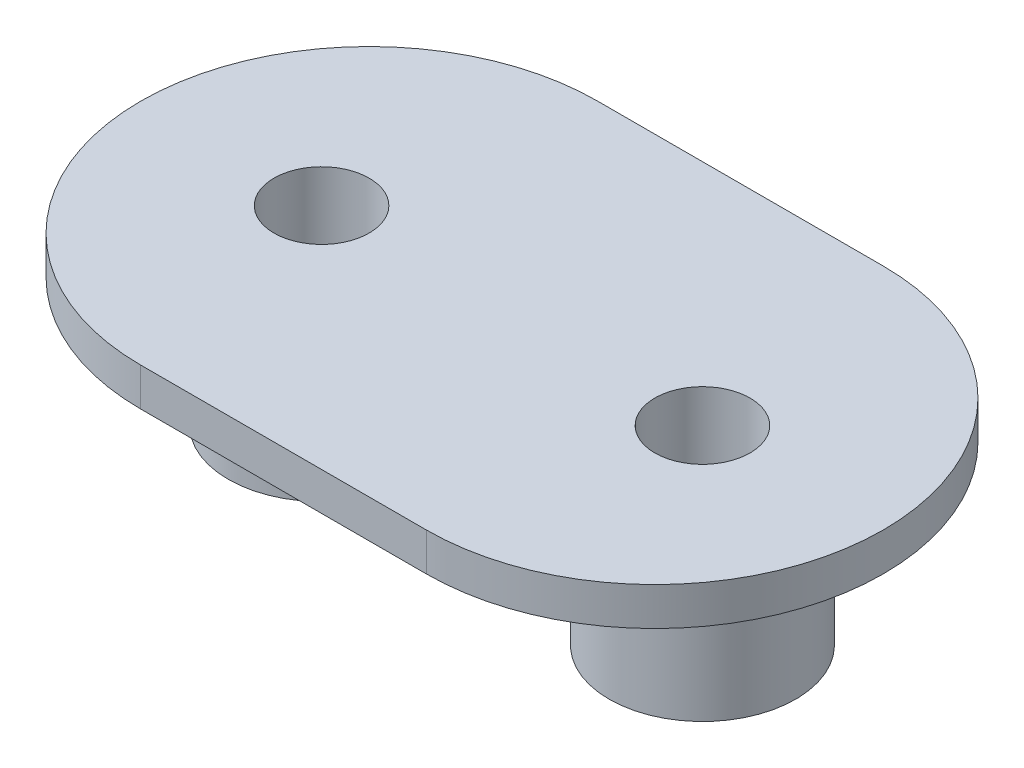
from build123d import *

# Parameters (mm, degrees)
SKETCH1_R                  = 4.9
BOSS_EXTRUDE1_DEPTH        = 2
BOSS_EXTRUDE2_DEPTH        = 2
BOSS_EXTRUDE2_DEPTH_BACK   = 8
SKETCH1_3_R                = 4.9
SKETCH1_3_R_2              = 2.5
BOSS_EXTRUDE2_2_DEPTH      = 2
BOSS_EXTRUDE2_2_DEPTH_BACK = 8
SKETCH2_R                  = 5.756408641
SKETCH2_R_2                = 3.886057863
SKETCH2_R_3                = 6.078413945
SKETCH2_R_4                = 3.85710511
BOSS_EXTRUDE3_DEPTH        = 2


with BuildPart() as part:
    # Sketch1 → Boss-Extrude1 (new body)
    with BuildSketch(Plane(origin=(0, 0, 0), x_dir=(1, 0, 0), z_dir=(0, 1, 0))):
        with BuildLine():
            Line((7.5, 12), (-7.5, 12))
            ThreePointArc((-7.5, 12), (-19.5, 0), (-7.5, -12))
            Line((-7.5, -12), (7.5, -12))
            ThreePointArc((7.5, -12), (19.5, 0), (7.5, 12))
        make_face()
        with Locations((-10, 0)):
            Circle(SKETCH1_R, mode=Mode.SUBTRACT)
        with Locations((10, 0)):
            Circle(SKETCH1_R, mode=Mode.SUBTRACT)
    extrude(amount=BOSS_EXTRUDE1_DEPTH)



with BuildPart() as body_2:
    # Sketch1<3> → Boss-Extrude2 (new, two sides: drawn at the far end of the back side and taken through both)
    with BuildSketch(Plane(origin=(0, 0, 0), x_dir=(1, 0, 0), z_dir=(0, 1, 0)).offset(-BOSS_EXTRUDE2_DEPTH_BACK)):
        with Locations((-10, 0)):
            Circle(SKETCH1_3_R)
        with Locations((-10, 0)):
            Circle(SKETCH1_3_R_2, mode=Mode.SUBTRACT)
    extrude(amount=BOSS_EXTRUDE2_DEPTH + BOSS_EXTRUDE2_DEPTH_BACK)


with BuildPart() as body_3:
    # Sketch1<3> → Boss-Extrude2 2 (new, two sides: drawn at the far end of the back side and taken through both)
    with BuildSketch(Plane(origin=(0, 0, 0), x_dir=(1, 0, 0), z_dir=(0, 1, 0)).offset(-BOSS_EXTRUDE2_2_DEPTH_BACK)):
        with Locations((10, 0)):
            Circle(SKETCH1_3_R)
        with Locations((10, 0)):
            Circle(SKETCH1_3_R_2, mode=Mode.SUBTRACT)
    extrude(amount=BOSS_EXTRUDE2_2_DEPTH + BOSS_EXTRUDE2_2_DEPTH_BACK)


with BuildPart() as part_1:
    add(part.part)

    add(body_2.part)  # Boss-Extrude3 merges body 2

    add(body_3.part)  # Boss-Extrude3 merges body 3
    # Sketch2 → Boss-Extrude3 (add)
    # profile 1 of 2: a face of its own
    with BuildSketch(Plane(origin=(0, 2, 0), x_dir=(1, 0, 0), z_dir=(0, 1, 0))):
        with Locations((-10, 0)):
            Circle(SKETCH2_R)
        with Locations((-10, 0)):
            Circle(SKETCH2_R_2, mode=Mode.SUBTRACT)
    # profile 2 of 2: a face of its own
    with BuildSketch(Plane(origin=(0, 2, 0), x_dir=(1, 0, 0), z_dir=(0, 1, 0))):
        with Locations((10, 0)):
            Circle(SKETCH2_R_3)
        with Locations((10, 0)):
            Circle(SKETCH2_R_4, mode=Mode.SUBTRACT)
    extrude(amount=-BOSS_EXTRUDE3_DEPTH)


solid = part_1.part
